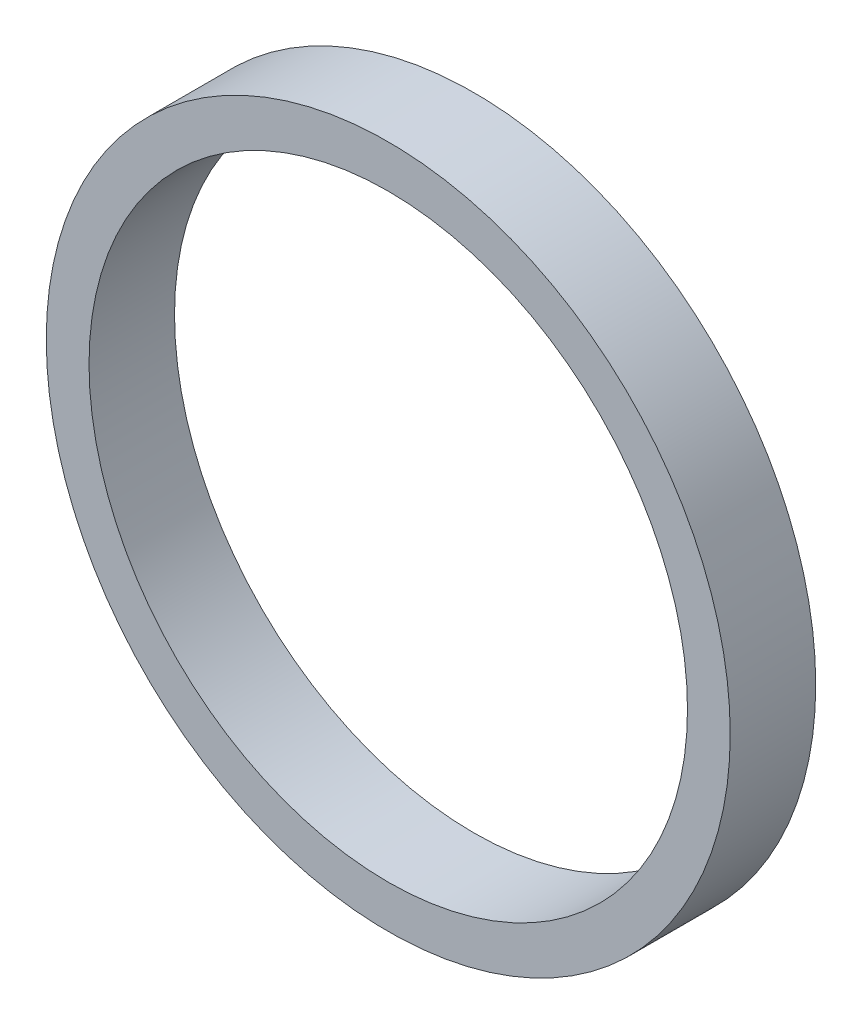
from build123d import *

# Parameters (mm, degrees)
SKETCH2_R           = 40
BOSS_EXTRUDE1_DEPTH = 5
SKETCH3_R           = 35
CUT_EXTRUDE1_DEPTH  = 58.445626465


with BuildPart() as part:
    # Sketch2 → Boss-Extrude1 (new, symmetric)
    with BuildSketch(Plane.XY):
        Circle(SKETCH2_R)
    extrude(amount=BOSS_EXTRUDE1_DEPTH, both=True)

    # Sketch3 → Cut-Extrude1 (cut, through all)
    with BuildSketch(Plane.XY.offset(5)):
        Circle(SKETCH3_R)
    extrude(amount=-CUT_EXTRUDE1_DEPTH, mode=Mode.SUBTRACT)


solid = part.part
